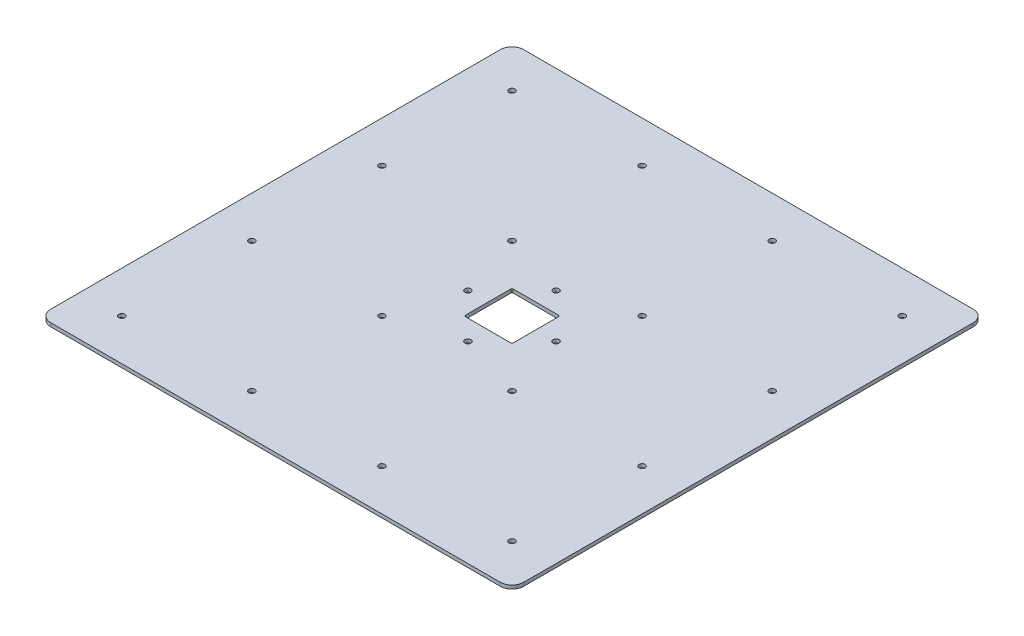
from build123d import *

# Parameters (mm, degrees)
SKETCH1_W           = 400
SKETCH1_H           = 400
BOSS_EXTRUDE1_DEPTH = 3
CUT_EXTRUDE1_DEPTH  = 283.85862193
SKETCH4_R           = 2.58
CUT_EXTRUDE2_DEPTH  = 283.85862193
SKETCH9_R           = 2.58
CUT_EXTRUDE4_DEPTH  = 283.85862193
FILLET1_R           = 10


with BuildPart() as part:
    # Sketch1 → Boss-Extrude1 (new body)
    with BuildSketch(Plane(origin=(0, 0, 0), x_dir=(1, 0, 0), z_dir=(0, 1, 0))):
        Rectangle(SKETCH1_W, SKETCH1_H)
    extrude(amount=BOSS_EXTRUDE1_DEPTH)

    # Sketch3 → Cut-Extrude1 (cut, through all)
    with BuildSketch(Plane(origin=(0, 3, 0), x_dir=(1, 0, 0), z_dir=(0, 1, 0))):
        with BuildLine():
            Line((-19.25, 20.25), (19.25, 20.25))
            ThreePointArc((19.25, 20.25), (19.957106781, 19.957106781), (20.25, 19.25))
            Line((20.25, 19.25), (20.25, -19.25))
            ThreePointArc((20.25, -19.25), (19.957106781, -19.957106781), (19.25, -20.25))
            Line((19.25, -20.25), (-19.25, -20.25))
            ThreePointArc((-19.25, -20.25), (-19.957106781, -19.957106781), (-20.25, -19.25))
            Line((-20.25, -19.25), (-20.25, 19.25))
            ThreePointArc((-20.25, 19.25), (-19.957106781, 19.957106781), (-19.25, 20.25))
        make_face()
    extrude(amount=-CUT_EXTRUDE1_DEPTH, mode=Mode.SUBTRACT)

    # Sketch4 → Cut-Extrude2 (cut, through all)
    with BuildSketch(Plane(origin=(0, 3, 0), x_dir=(1, 0, 0), z_dir=(0, 1, 0))):
        with Locations(Location((-37.25, 0, 0), (0, 0, 270))):
            Circle(SKETCH4_R)
        with Locations(Location((0, 37.25, 0), (0, 0, 270))):
            Circle(SKETCH4_R)
        with Locations(Location((37.25, 0, 0), (0, 0, 270))):
            Circle(SKETCH4_R)
        with Locations(Location((0, -37.25, 0), (0, 0, 270))):
            Circle(SKETCH4_R)
    extrude(amount=-CUT_EXTRUDE2_DEPTH, mode=Mode.SUBTRACT)

    # Sketch9 → Cut-Extrude4 (cut, through all)
    with BuildSketch(Plane(origin=(0, 3, 0), x_dir=(1, 0, 0), z_dir=(0, 1, 0))):
        with Locations(Location((-165, 165, 0), (0, 0, 270))):
            Circle(SKETCH9_R)
        with Locations(Location((-55, 165, 0), (0, 0, 270))):
            Circle(SKETCH9_R)
        with Locations(Location((55, 165, 0), (0, 0, 270))):
            Circle(SKETCH9_R)
        with Locations(Location((165, 165, 0), (0, 0, 270))):
            Circle(SKETCH9_R)
        with Locations(Location((-55, 55, 0), (0, 0, 270))):
            Circle(SKETCH9_R)
        with Locations(Location((55, 55, 0), (0, 0, 270))):
            Circle(SKETCH9_R)
        with Locations(Location((165, 55, 0), (0, 0, 270))):
            Circle(SKETCH9_R)
        with Locations(Location((-55, -55, 0), (0, 0, 270))):
            Circle(SKETCH9_R)
        with Locations(Location((55, -55, 0), (0, 0, 270))):
            Circle(SKETCH9_R)
        with Locations(Location((165, -55, 0), (0, 0, 270))):
            Circle(SKETCH9_R)
        with Locations(Location((-55, -165, 0), (0, 0, 270))):
            Circle(SKETCH9_R)
        with Locations(Location((55, -165, 0), (0, 0, 270))):
            Circle(SKETCH9_R)
        with Locations(Location((165, -165, 0), (0, 0, 270))):
            Circle(SKETCH9_R)
        with Locations(Location((-165, 55, 0), (0, 0, 270))):
            Circle(SKETCH9_R)
        with Locations(Location((-165, -55, 0), (0, 0, 270))):
            Circle(SKETCH9_R)
        with Locations(Location((-165, -165, 0), (0, 0, 270))):
            Circle(SKETCH9_R)
    extrude(amount=-CUT_EXTRUDE4_DEPTH, mode=Mode.SUBTRACT)

    # Fillet1
    fillet1_edges = [part.edges().sort_by_distance(p)[0] for p in [
        (200, 1.5, 200),
        (-200, 1.5, 200),
        (-200, 1.5, -200),
        (200, 1.5, -200),
    ]]
    fillet(fillet1_edges, radius=FILLET1_R)


solid = part.part
